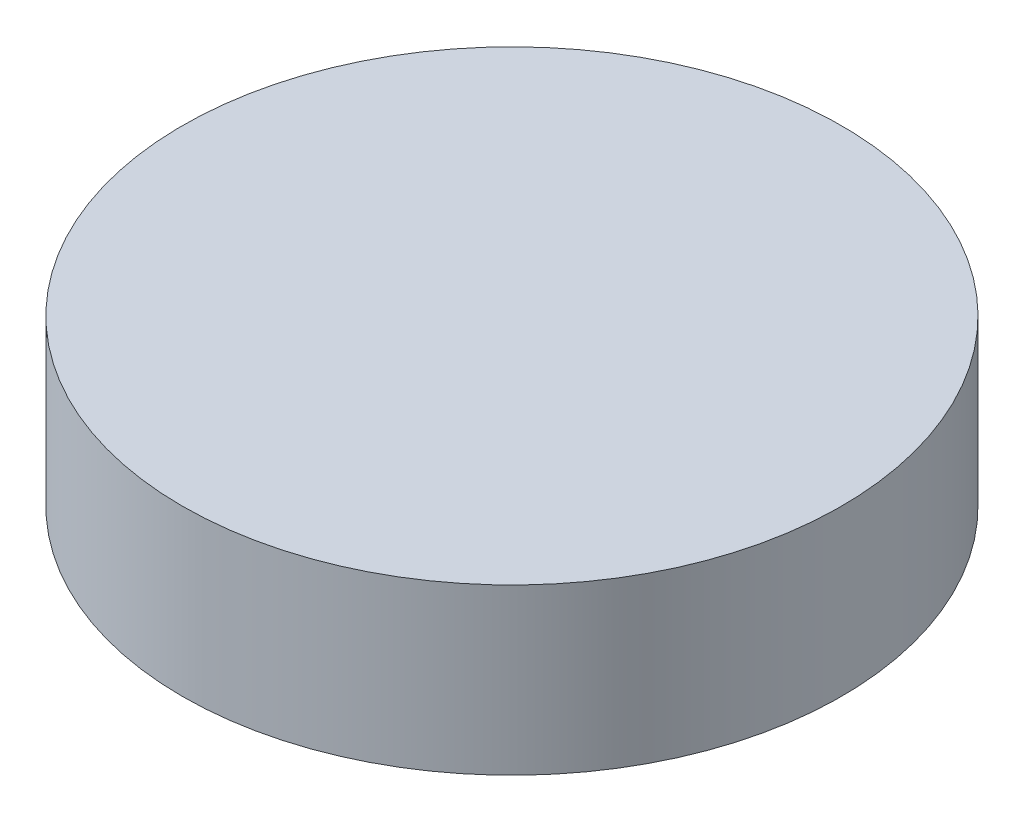
from build123d import *

# Parameters (mm, degrees)
CROQUIS1_R              = 4
SALIENTE_EXTRUIR1_DEPTH = 2


with BuildPart() as part:
    # Croquis1 → Saliente-Extruir1 (new body)
    with BuildSketch(Plane(origin=(0, 0, 0), x_dir=(1, 0, 0), z_dir=(0, 1, 0))):
        with Locations(Location((0, 0, 0), (0, 0, 270))):
            Circle(CROQUIS1_R)
    extrude(amount=SALIENTE_EXTRUIR1_DEPTH)


solid = part.part
